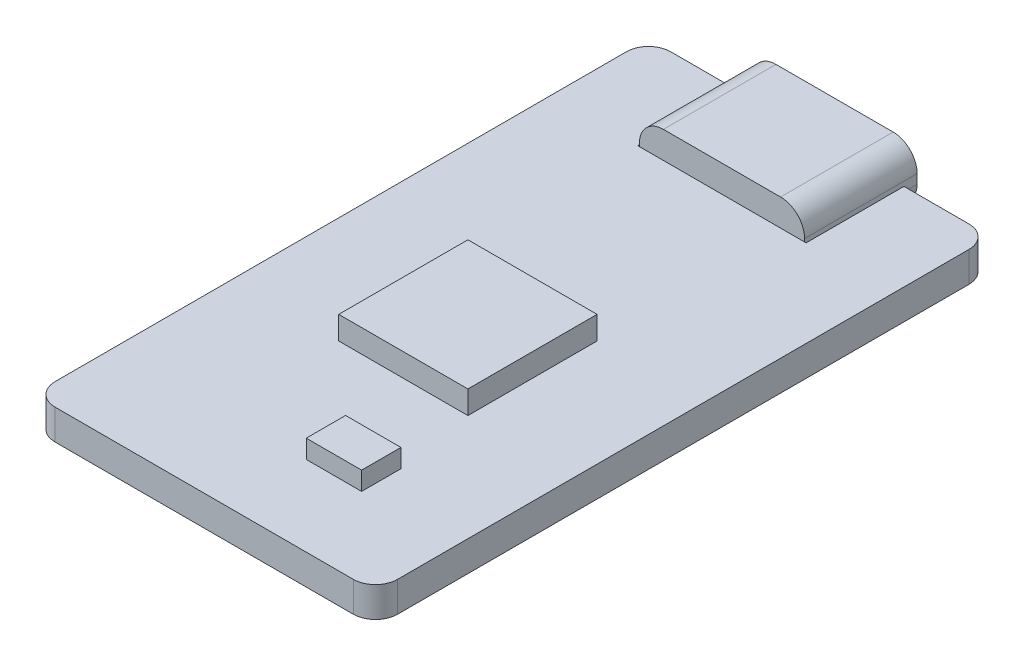
from build123d import *

# Parameters (mm, degrees)
SKETCH1_W           = 18.56
SKETCH1_H           = 33.36
BOSS_EXTRUDE1_DEPTH = 1.64
FILLET1_R           = 1.2
SKETCH2_W           = 9.12
SKETCH2_H           = 5.3
CUT_EXTRUDE1_DEPTH  = 35.665510237
BOSS_EXTRUDE2_DEPTH = 6.1
SKETCH4_W           = 6.35
SKETCH4_H           = 0.5
CUT_EXTRUDE2_DEPTH  = 5
SKETCH5_W           = 6.35
SKETCH5_H           = 0.5
CUT_EXTRUDE3_DEPTH  = 0.4
SKETCH7_W           = 7
SKETCH7_H           = 7
BOSS_EXTRUDE3_DEPTH = 1.25
SKETCH8_W           = 3
SKETCH8_H           = 2.13
BOSS_EXTRUDE4_DEPTH = 1


with BuildPart() as part:
    # Sketch1 → Boss-Extrude1 (new body)
    with BuildSketch(Plane(origin=(0, 0, 0), x_dir=(1, 0, 0), z_dir=(0, 1, 0))):
        with Locations((0, -16.68)):
            Rectangle(SKETCH1_W, SKETCH1_H)
    extrude(amount=BOSS_EXTRUDE1_DEPTH)

    # Fillet1
    fillet1_edges = [part.edges().sort_by_distance(p)[0] for p in [
        (-9.28, 0.82, 0),
        (9.28, 0.82, 0),
        (9.28, 0.82, 33.36),
        (-9.28, 0.82, 33.36),
    ]]
    fillet(fillet1_edges, radius=FILLET1_R)

    # Sketch2 → Cut-Extrude1 (cut, through all)
    with BuildSketch(Plane(origin=(0, 1.64, 0), x_dir=(1, 0, 0), z_dir=(0, 1, 0))):
        with Locations((0, -2.65)):
            Rectangle(SKETCH2_W, SKETCH2_H)
    extrude(amount=-CUT_EXTRUDE1_DEPTH, mode=Mode.SUBTRACT)

    # Sketch3 → Boss-Extrude2 (add)
    with BuildSketch(Plane(origin=(0, 0, 5.3), x_dir=(-1, 0, 0), z_dir=(0, 0, -1))):
        with BuildLine():
            Line((-3.175, 0), (3.175, 0))
            ThreePointArc((3.175, 0), (4.094238816, 0.380761184), (4.475, 1.3))
            Line((4.475, 1.3), (4.475, 1.8))
            ThreePointArc((4.475, 1.8), (4.094238816, 2.719238816), (3.175, 3.1))
            Line((3.175, 3.1), (-3.175, 3.1))
            ThreePointArc((-3.175, 3.1), (-4.094238816, 2.719238816), (-4.475, 1.8))
            Line((-4.475, 1.8), (-4.475, 1.3))
            ThreePointArc((-4.475, 1.3), (-4.094238816, 0.380761184), (-3.175, 0))
        make_face()
    extrude(amount=BOSS_EXTRUDE2_DEPTH)

    # Sketch4 → Cut-Extrude2 (cut)
    with BuildSketch(Plane(origin=(0, 0, -0.8), x_dir=(-1, 0, 0), z_dir=(0, 0, -1))):
        with BuildLine():
            Line((3.175, 2.8), (-3.175, 2.8))
            ThreePointArc((-3.175, 2.8), (-3.882106781, 2.507106781), (-4.175, 1.8))
            Line((-4.175, 1.8), (-4.175, 1.3))
            ThreePointArc((-4.175, 1.3), (-3.882106781, 0.592893219), (-3.175, 0.3))
            Line((-3.175, 0.3), (3.175, 0.3))
            ThreePointArc((3.175, 0.3), (3.882106781, 0.592893219), (4.175, 1.3))
            Line((4.175, 1.3), (4.175, 1.8))
            ThreePointArc((4.175, 1.8), (3.882106781, 2.507106781), (3.175, 2.8))
        make_face()
        with Locations((0, 1.55)):
            Rectangle(SKETCH4_W, SKETCH4_H, mode=Mode.SUBTRACT)
    extrude(amount=-CUT_EXTRUDE2_DEPTH, mode=Mode.SUBTRACT)

    # Sketch5 → Cut-Extrude3 (cut)
    with BuildSketch(Plane(origin=(0, 0, -0.8), x_dir=(-1, 0, 0), z_dir=(0, 0, -1))):
        with Locations((0, 1.55)):
            Rectangle(SKETCH5_W, SKETCH5_H)
    extrude(amount=-CUT_EXTRUDE3_DEPTH, mode=Mode.SUBTRACT)

    # Sketch7 → Boss-Extrude3 (add)
    with BuildSketch(Plane(origin=(0, 1.64, 0), x_dir=(1, 0, 0), z_dir=(0, 1, 0))):
        with Locations((0, -19.07)):
            Rectangle(SKETCH7_W, SKETCH7_H)
    extrude(amount=BOSS_EXTRUDE3_DEPTH)

    # Sketch8 → Boss-Extrude4 (add)
    with BuildSketch(Plane(origin=(0, 1.64, 0), x_dir=(1, 0, 0), z_dir=(0, 1, 0))):
        with Locations((2.68, -27.945)):
            Rectangle(SKETCH8_W, SKETCH8_H)
    extrude(amount=BOSS_EXTRUDE4_DEPTH)


solid = part.part
